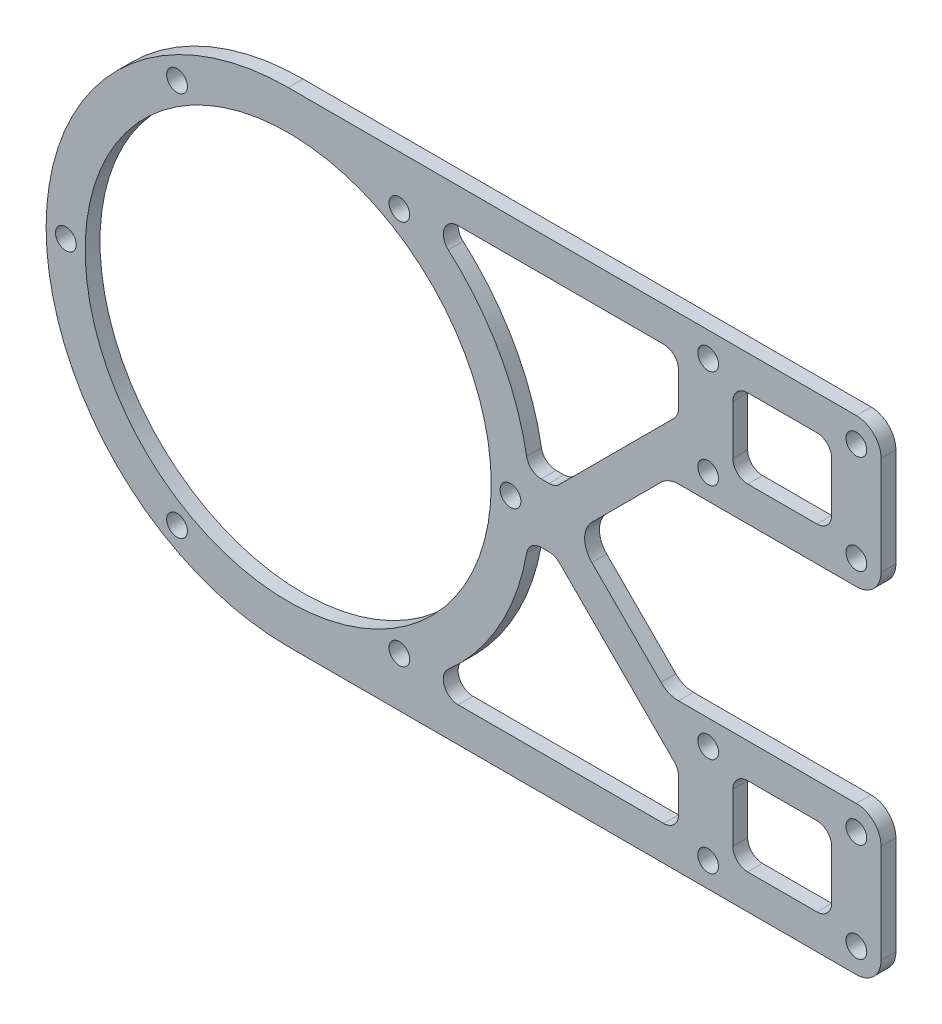
from build123d import *

# Parameters (mm, degrees)
SKETCH_1_R          = 2.1
SKETCH_1_R_2        = 41.1
EXTRUDE_1_DEPTH     = 3
SKETCH_2_R          = 2.1
CUT_EXTRUDE_1_DEPTH = 3


with BuildPart() as part:
    # 草图1 → 凸台-拉伸1 (new body)
    with BuildSketch(Plane.XY):
        with BuildLine():
            Line((0, 49), (115, 49))
            ThreePointArc((115, 49), (118.535533906, 47.535533906), (120, 44))
            Line((120, 44), (120, 24))
            ThreePointArc((120, 24), (118.535533906, 20.464466094), (115, 19))
            Line((115, 19), (79, 19))
            ThreePointArc((79, 19), (77.086582838, 18.619397663), (75.464466094, 17.535533906))
            Line((75.464466094, 17.535533906), (61.464466094, 3.535533906))
            ThreePointArc((61.464466094, 3.535533906), (60, 0), (61.464466094, -3.535533906))
            Line((61.464466094, -3.535533906), (75.464466094, -17.535533906))
            ThreePointArc((75.464466094, -17.535533906), (77.086582838, -18.619397663), (79, -19))
            Line((79, -19), (115, -19))
            ThreePointArc((115, -19), (118.535533906, -20.464466094), (120, -24))
            Line((120, -24), (120, -44))
            ThreePointArc((120, -44), (118.535533906, -47.535533906), (115, -49))
            Line((115, -49), (0, -49))
            ThreePointArc((0, -49), (-49, 0), (0, 49))
        make_face()
        with Locations((-45, 0)):
            Circle(SKETCH_1_R, mode=Mode.SUBTRACT)
        with Locations((-22.5, 38.97114317)):
            Circle(SKETCH_1_R, mode=Mode.SUBTRACT)
        with Locations((22.5, 38.97114317)):
            Circle(SKETCH_1_R, mode=Mode.SUBTRACT)
        with Locations((45, 0)):
            Circle(SKETCH_1_R, mode=Mode.SUBTRACT)
        with Locations((22.5, -38.97114317)):
            Circle(SKETCH_1_R, mode=Mode.SUBTRACT)
        with Locations((-22.5, -38.97114317)):
            Circle(SKETCH_1_R, mode=Mode.SUBTRACT)
        Circle(SKETCH_1_R_2, mode=Mode.SUBTRACT)
        with BuildLine():
            Line((93, -42), (107, -42))
            ThreePointArc((107, -42), (109.121320344, -41.121320344), (110, -39))
            Line((110, -39), (110, -29))
            ThreePointArc((110, -29), (109.121320344, -26.878679656), (107, -26))
            Line((107, -26), (93, -26))
            ThreePointArc((93, -26), (90.878679656, -26.878679656), (90, -29))
            Line((90, -29), (90, -39))
            ThreePointArc((90, -39), (90.878679656, -41.121320344), (93, -42))
        make_face(mode=Mode.SUBTRACT)
        with BuildLine():
            Line((34.394767044, -42), (76, -42))
            ThreePointArc((76, -42), (78.121320344, -41.121320344), (79, -39))
            Line((79, -39), (79, -32.213203436))
            ThreePointArc((79, -32.213203436), (78.771638598, -31.065153138), (78.121320344, -30.091883092))
            Line((78.121320344, -30.091883092), (54.908116908, -6.878679656))
            ThreePointArc((54.908116908, -6.878679656), (53.934846861, -6.228361402), (52.786796564, -6))
            Line((52.786796564, -6), (51.215232109, -6))
            ThreePointArc((51.215232109, -6), (49.28620286, -6.702426029), (48.26050718, -8.480769231))
            ThreePointArc((48.26050718, -8.480769231), (42.740359483, -23.963757452), (32.410453561, -36.75))
            ThreePointArc((32.410453561, -36.75), (31.588524004, -40.060660172), (34.394767044, -42))
        make_face(mode=Mode.SUBTRACT)
        with BuildLine():
            Line((93, 26), (107, 26))
            ThreePointArc((107, 26), (109.121320344, 26.878679656), (110, 29))
            Line((110, 29), (110, 39))
            ThreePointArc((110, 39), (109.121320344, 41.121320344), (107, 42))
            Line((107, 42), (93, 42))
            ThreePointArc((93, 42), (90.878679656, 41.121320344), (90, 39))
            Line((90, 39), (90, 29))
            ThreePointArc((90, 29), (90.878679656, 26.878679656), (93, 26))
        make_face(mode=Mode.SUBTRACT)
        with BuildLine():
            Line((51.215232109, 6), (52.786796564, 6))
            ThreePointArc((52.786796564, 6), (53.934846861, 6.228361402), (54.908116908, 6.878679656))
            Line((54.908116908, 6.878679656), (78.121320344, 30.091883092))
            ThreePointArc((78.121320344, 30.091883092), (78.771638598, 31.065153139), (79, 32.213203436))
            Line((79, 32.213203436), (79, 39))
            ThreePointArc((79, 39), (78.121320344, 41.121320344), (76, 42))
            Line((76, 42), (34.394767044, 42))
            ThreePointArc((34.394767044, 42), (31.588524004, 40.060660172), (32.410453561, 36.75))
            ThreePointArc((32.410453561, 36.75), (42.740359483, 23.963757452), (48.26050718, 8.480769231))
            ThreePointArc((48.26050718, 8.480769231), (49.28620286, 6.702426029), (51.215232109, 6))
        make_face(mode=Mode.SUBTRACT)
    extrude(amount=EXTRUDE_1_DEPTH)

    # 草图2 → 切除-拉伸1 (cut)
    with BuildSketch(Plane.XY):
        with Locations((85, 44)):
            Circle(SKETCH_2_R)
        with Locations((115, 44)):
            Circle(SKETCH_2_R)
        with Locations(Location((115, 24, 0), (0, 0, 180))):
            Circle(SKETCH_2_R)
        with Locations(Location((85, 24, 0), (0, 0, 180))):
            Circle(SKETCH_2_R)
        with Locations((85, -24)):
            Circle(SKETCH_2_R)
        with Locations((115, -24)):
            Circle(SKETCH_2_R)
        with Locations(Location((115, -44, 0), (0, 0, 180))):
            Circle(SKETCH_2_R)
        with Locations(Location((85, -44, 0), (0, 0, 180))):
            Circle(SKETCH_2_R)
    extrude(amount=CUT_EXTRUDE_1_DEPTH, mode=Mode.SUBTRACT)


solid = part.part
